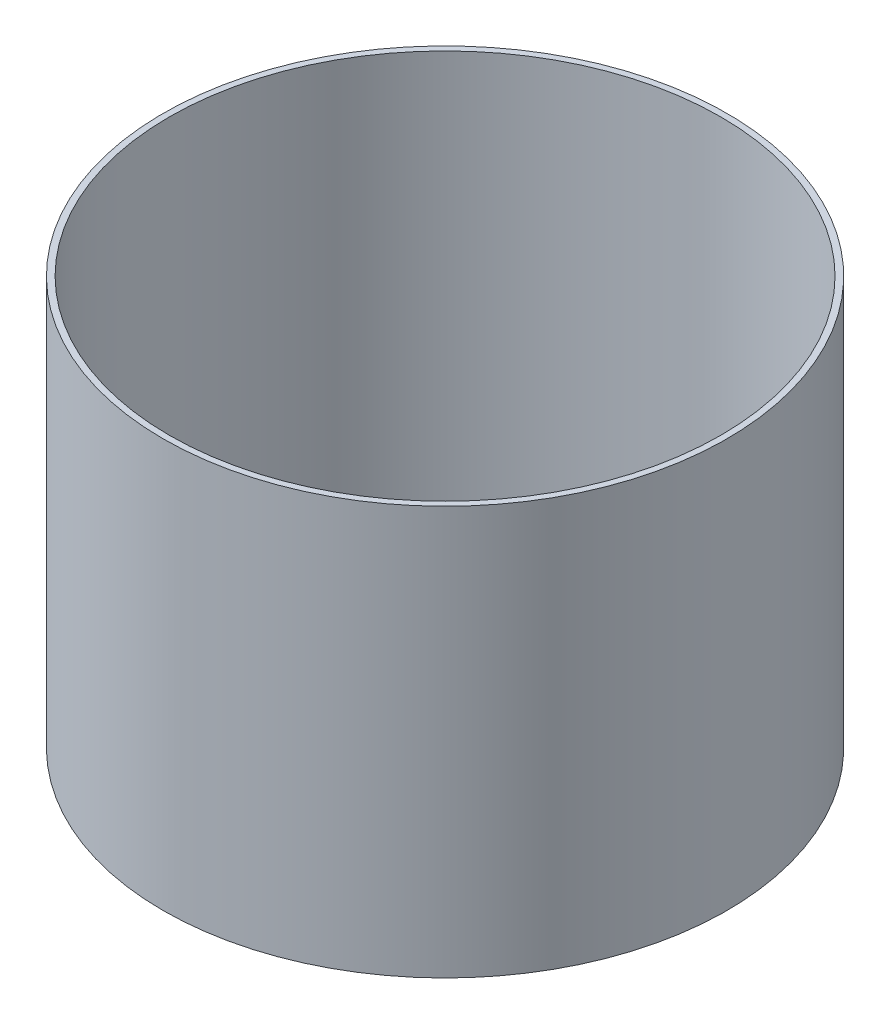
from build123d import *

# Parameters (mm, degrees)
SKETCH2_R           = 690
SKETCH2_R_2         = 675
BOSS_EXTRUDE1_DEPTH = 1000


with BuildPart() as part:
    # Sketch2 → Boss-Extrude1 (new body)
    with BuildSketch(Plane(origin=(0, 0, 0), x_dir=(1, 0, 0), z_dir=(0, 1, 0))):
        with Locations(Location((0, 0, 0), (0, 0, 270))):
            Circle(SKETCH2_R)
        with Locations(Location((0, 0, 0), (0, 0, 270))):
            Circle(SKETCH2_R_2, mode=Mode.SUBTRACT)
    extrude(amount=BOSS_EXTRUDE1_DEPTH)


solid = part.part
